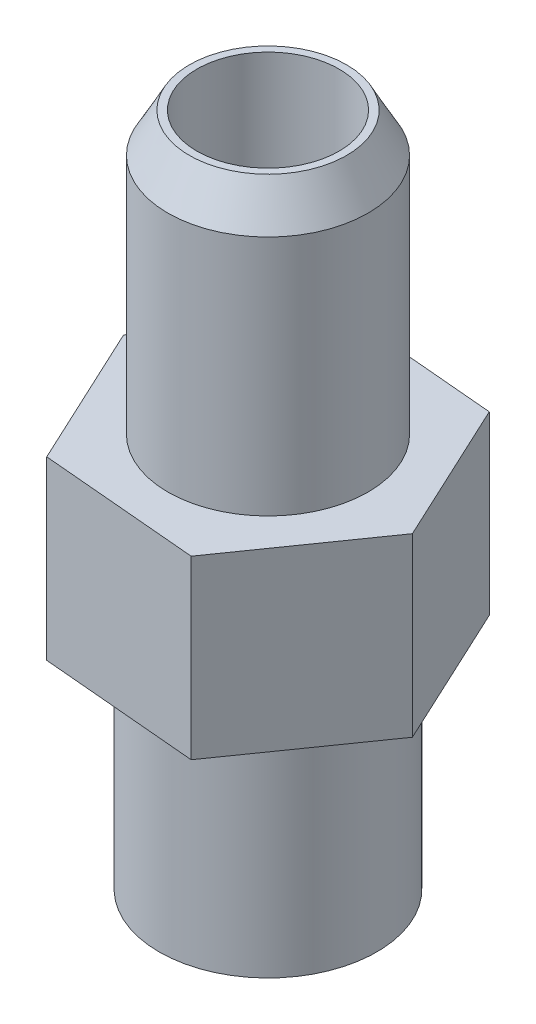
from build123d import *

# Parameters (mm, degrees)
BOSS_EXTRUDE1_DEPTH = 8.1
SKETCH3_R           = 3.268605963
CUT_EXTRUDE1_DEPTH  = 40


with BuildPart() as part:
    # Sketch1 → Revolve1 (revolve)
    with BuildSketch(Plane.XY, mode=Mode.PRIVATE) as revolve1_sk:
        Polygon((0, 0), (0, 31), (3.611174949, 31), (4.6, 29.2), (4.6, 18.1), (6.3, 18.1), (6.3, 10), (5, 10), (5, 0), align=None)
    revolve(revolve1_sk.sketch.rotate(Axis((0, 0, 0), (0, 1, 0)), 90), axis=Axis((0, 0, 0), (0, 1, 0)))

    # Sketch2 → Boss-Extrude1 (add)
    with BuildSketch(Plane(origin=(0, 18.1, 0), x_dir=(1, 0, 0), z_dir=(0, 1, 0))):
        Polygon((7.271508979, -0.636593264), (4.187060428, 5.979014867), (-3.08444855, 6.615608132), (-7.271508979, 0.636593264), (-4.187060428, -5.979014867), (3.08444855, -6.615608132), align=None)
    extrude(amount=-BOSS_EXTRUDE1_DEPTH)

    # Sketch3 → Cut-Extrude1 (cut)
    with BuildSketch(Plane(origin=(0, 31, 0), x_dir=(1, 0, 0), z_dir=(0, 1, 0))):
        with Locations(Location((0, 0, 0), (0, 0, 270))):
            Circle(SKETCH3_R)
    extrude(amount=-CUT_EXTRUDE1_DEPTH, mode=Mode.SUBTRACT)


solid = part.part
